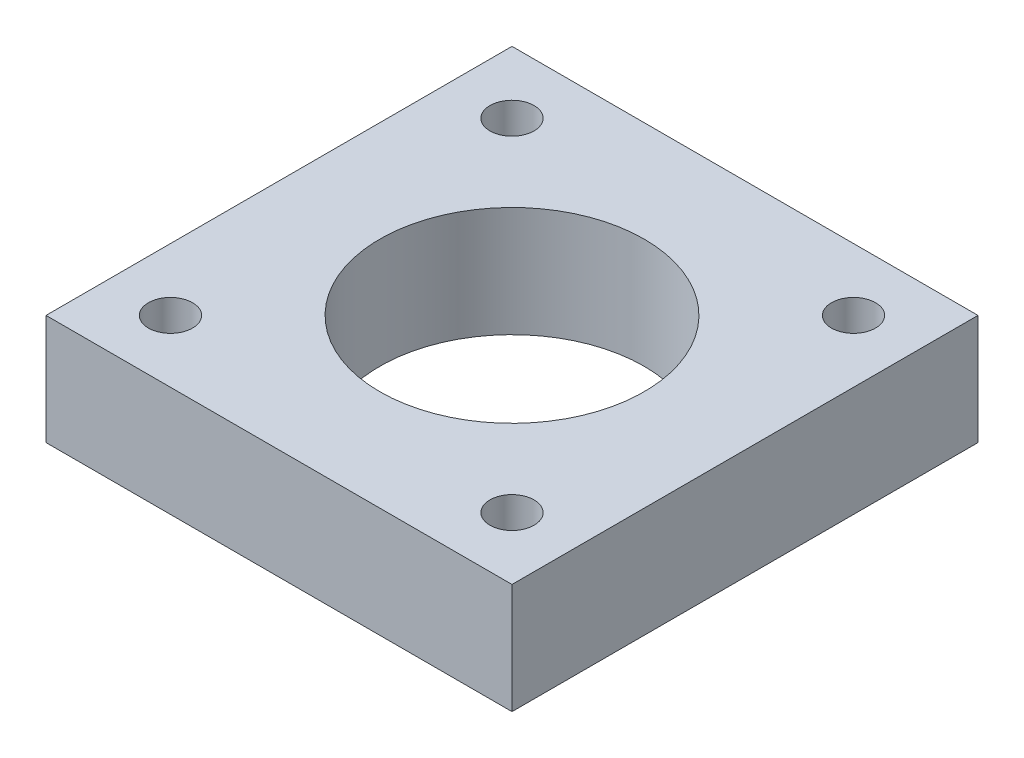
from build123d import *

# Parameters (mm, degrees)
SKETCH1_W           = 42.3
SKETCH1_H           = 42.3
SKETCH1_R           = 2
SKETCH1_R_2         = 12
BOSS_EXTRUDE1_DEPTH = 10


with BuildPart() as part:
    # Sketch1 → Boss-Extrude1 (new body)
    with BuildSketch(Plane(origin=(0, 0, 0), x_dir=(1, 0, 0), z_dir=(0, 1, 0))):
        Rectangle(SKETCH1_W, SKETCH1_H)
        with Locations(Location((15.5, 15.5, 0), (0, 0, 270))):
            Circle(SKETCH1_R, mode=Mode.SUBTRACT)
        with Locations(Location((15.5, -15.5, 0), (0, 0, 270))):
            Circle(SKETCH1_R, mode=Mode.SUBTRACT)
        with Locations(Location((-15.5, 15.5, 0), (0, 0, 270))):
            Circle(SKETCH1_R, mode=Mode.SUBTRACT)
        with Locations(Location((-15.5, -15.5, 0), (0, 0, 270))):
            Circle(SKETCH1_R, mode=Mode.SUBTRACT)
        with Locations(Location((0, 0, 0), (0, 0, 270))):
            Circle(SKETCH1_R_2, mode=Mode.SUBTRACT)
    extrude(amount=BOSS_EXTRUDE1_DEPTH)


solid = part.part
